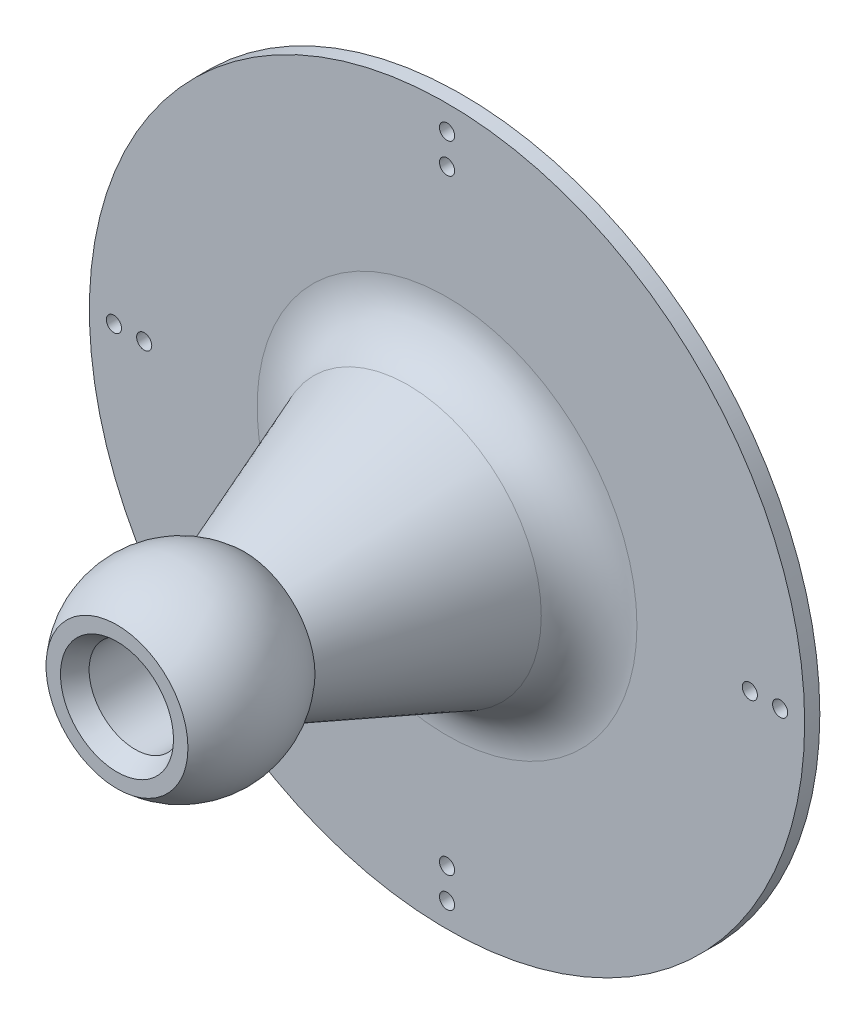
from build123d import *

# Parameters (mm, degrees)
SKETCH2_R          = 28.533493352
CUT_EXTRUDE1_DEPTH = 3.900597164
CUT_EXTRUDE1_DRAFT = -65.378461827
HOLE1_D            = 3.175
HOLE1_DEPTH        = 72.381695866
CHAMFER1_SIZE      = 2.199704526
CHAMFER1_SIZE2     = 3.81
FILLET1_R          = 12.7


with BuildPart() as part:
    # Sketch1 → Revolve1 (revolve)
    with BuildSketch(Plane(origin=(0, 0, 0), x_dir=(1, 0, 0), z_dir=(0, 1, 0))):
        with BuildLine():
            Line((75, 1.293744634), (0, 1.293744634))
            Line((0, 1.293744634), (0, -2.606852529))
            Line((0, -2.606852529), (20.022304736, -2.606852529))
            ThreePointArc((20.022304736, -2.606852529), (17.926393777, -14.259573819), (9.652, -22.727936343))
            Line((9.652, -22.727936343), (9.652, -71.087951232))
            Line((9.652, -71.087951232), (14.88071719, -71.087951232))
            ThreePointArc((14.88071719, -71.087951232), (19.97075, -57.768975616), (14.88071719, -44.45))
            Line((14.88071719, -44.45), (31.064900574, -1.881255366))
            Line((31.064900574, -1.881255366), (75, -1.881255366))
            Line((75, -1.881255366), (75, 1.293744634))
        make_face()
    revolve(axis=Axis((0, 0, -1.293744634), (0, 0, 1)))


with BuildPart() as cut_extrude1_tool:
    # Sketch2 → Cut-Extrude1 (with draft: the straight prism first)
    with BuildSketch(Plane(origin=(0, 0, -1.293744634), x_dir=(-1, 0, 0), z_dir=(0, 0, -1))):
        Circle(SKETCH2_R)
    extrude(amount=-CUT_EXTRUDE1_DEPTH)
    # Cut-Extrude1: the draft: its side faces are tilted about the plane it starts from
    cut_extrude1_sides = [cut_extrude1_tool.faces().sort_by_distance(p)[0] for p in [
        (28.533493352, 0, 0.656553947),
    ]]
    draft(cut_extrude1_sides, Plane(origin=(0, 0, -1.293744634), x_dir=(-1, 0, 0), z_dir=(0, 0, -1)), CUT_EXTRUDE1_DRAFT)


with BuildPart() as part_1:
    add(part.part)

    # Cut-Extrude1: cut by cut_extrude1_tool
    add(cut_extrude1_tool.part, mode=Mode.SUBTRACT)

    # Hole1
    with Locations(Plane(origin=(0, 0, -1.293744634), x_dir=(-1, 0, 0), z_dir=(0, 0, -1))):
        with Locations((-63.5, 0), (-69.85, 0), (0, 63.5), (0, 69.85), (63.5, 0), (69.85, 0), (0, -63.5), (0, -69.85)):
            Hole(HOLE1_D / 2, depth=HOLE1_DEPTH)

    # Chamfer1
    chamfer1_edges = [part_1.edges().sort_by_distance(p)[0] for p in [
        (-9.652, 0, 71.087951232),
    ]]
    chamfer1_side = [part_1.faces().sort_by_distance(p)[0] for p in [
        (-10.072890241, 0, 71.087951232),
    ]]
    chamfer(chamfer1_edges, length=CHAMFER1_SIZE, length2=CHAMFER1_SIZE2, reference=chamfer1_side[0])

    # Fillet1
    fillet1_edges = [part_1.edges().sort_by_distance(p)[0] for p in [
        (-31.064900574, 0, 1.881255366),
        (28.533493352, 0, -1.293744634),
    ]]
    fillet(fillet1_edges, radius=FILLET1_R)


solid = part_1.part
